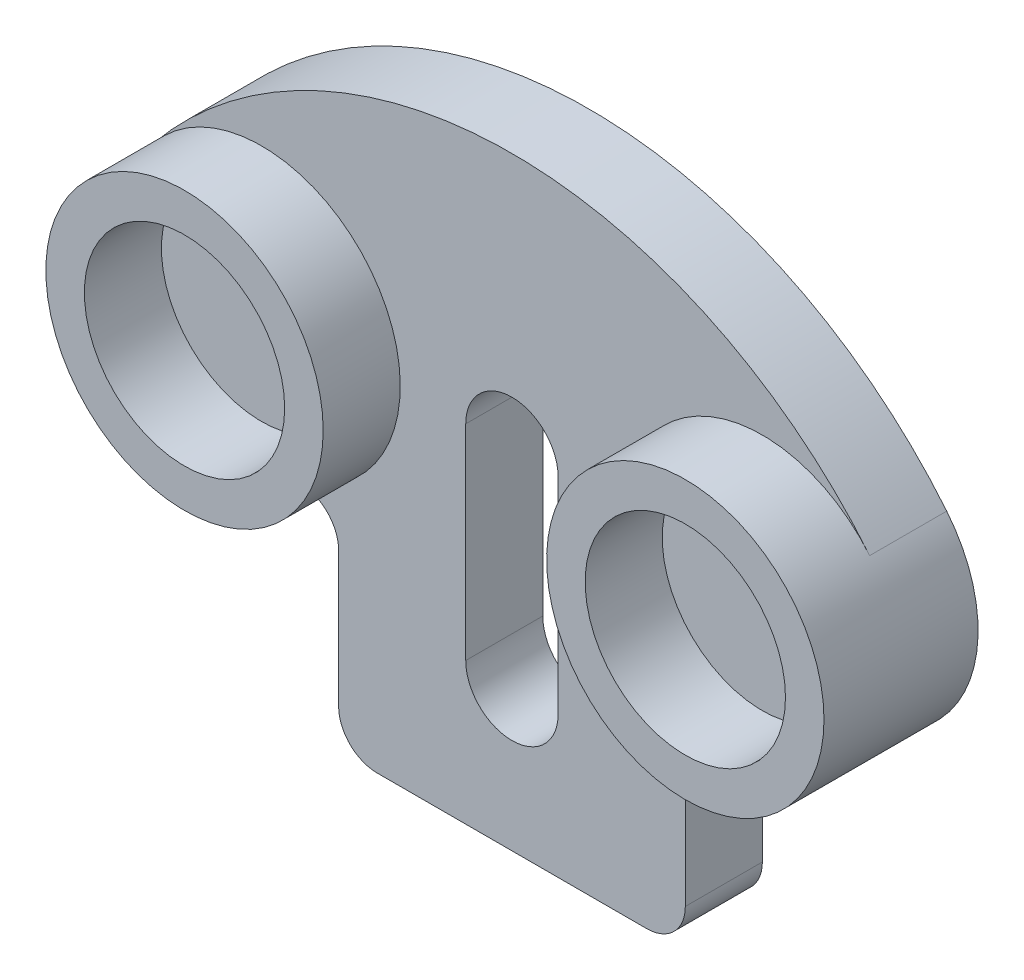
from build123d import *
from build123d.topology import SkipClean

# Parameters (mm, degrees)
SKETCH1_R           = 18
SKETCH1_R_2         = 13
BOSS_EXTRUDE1_DEPTH = 10
BOSS_EXTRUDE2_START = 10
SKETCH1_3_R         = 18
SKETCH1_3_R_2       = 13
BOSS_EXTRUDE2_DEPTH = 10


with BuildPart() as part:
    # Sketch1 → Boss-Extrude1 (new body)
    # profile 1 of 5: a face of its own
    with BuildSketch(Plane.XY):
        with BuildLine():
            Line((-17.5, -18.396428811), (17.5, -18.396428811))
            ThreePointArc((17.5, -18.396428811), (21.035533906, -16.931962717), (22.5, -13.396428811))
            Line((22.5, -13.396428811), (22.5, 4.153626868))
            ThreePointArc((22.5, 4.153626868), (24.372283789, 8.054574356), (28.586956522, 9.034049547))
            ThreePointArc((28.586956522, 9.034049547), (17.17328588, 36.042418273), (46.428571429, 38.005101698))
            ThreePointArc((46.428571429, 38.005101698), (0, 60), (-46.428571429, 38.005101698))
            ThreePointArc((-46.428571429, 38.005101698), (-26.446665618, 43.555182996), (-14.5, 26.603571189))
            ThreePointArc((-14.5, 26.603571189), (-18.456589043, 15.34379283), (-28.586956522, 9.034049547))
            ThreePointArc((-28.586956522, 9.034049547), (-24.372283789, 8.054574356), (-22.5, 4.153626868))
            Line((-22.5, 4.153626868), (-22.5, -13.396428811))
            ThreePointArc((-22.5, -13.396428811), (-21.035533906, -16.931962717), (-17.5, -18.396428811))
        make_face()
        with BuildLine():
            ThreePointArc((6, 0), (0, -6), (-6, 0))
            Line((-6, 0), (-6, 26.603571189))
            ThreePointArc((-6, 26.603571189), (0, 32.603571189), (6, 26.603571189))
            Line((6, 26.603571189), (6, 0))
        make_face(mode=Mode.SUBTRACT)
    # profile 2 of 5: a face of its own
    with BuildSketch(Plane.XY):
        with Locations((-32.5, 26.603571189)):
            Circle(SKETCH1_R)
        with Locations((-32.5, 26.603571189)):
            Circle(SKETCH1_R_2, mode=Mode.SUBTRACT)
    # profile 3 of 5: a face of its own
    with BuildSketch(Plane.XY):
        with Locations((-32.5, 26.603571189)):
            Circle(SKETCH1_R_2)
    # profile 4 of 5: a face of its own
    with BuildSketch(Plane.XY):
        with Locations((32.5, 26.603571189)):
            Circle(SKETCH1_R)
        with Locations((32.5, 26.603571189)):
            Circle(SKETCH1_R_2, mode=Mode.SUBTRACT)
    # profile 5 of 5: a face of its own
    with BuildSketch(Plane.XY):
        with Locations((32.5, 26.603571189)):
            Circle(SKETCH1_R_2)
    extrude(amount=BOSS_EXTRUDE1_DEPTH)

    # Sketch1<3> → Boss-Extrude2 (add)
    # profile 1 of 2: a face of its own
    with SkipClean():  # the faces are left unmerged after this step: merging them gives an invalid solid
        with BuildSketch(Plane.XY.offset(BOSS_EXTRUDE2_START)):
            with Locations(Location((-32.5, 26.603571189, 0), (0, 0, 140.697224227))):
                Circle(SKETCH1_3_R)
            with Locations((-32.5, 26.603571189)):
                Circle(SKETCH1_3_R_2, mode=Mode.SUBTRACT)
        # profile 2 of 2: a face of its own
        with BuildSketch(Plane.XY.offset(BOSS_EXTRUDE2_START)):
            with Locations(Location((32.5, 26.603571189, 0), (0, 0, 257.444142201))):
                Circle(SKETCH1_3_R)
            with Locations((32.5, 26.603571189)):
                Circle(SKETCH1_3_R_2, mode=Mode.SUBTRACT)
        extrude(amount=BOSS_EXTRUDE2_DEPTH)


solid = part.part
